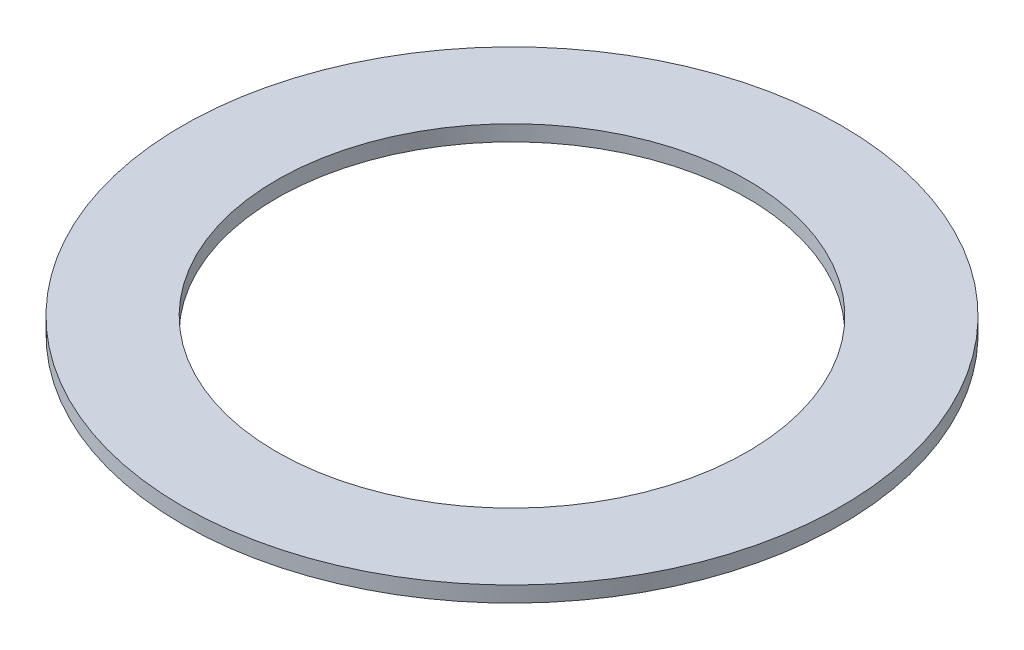
from build123d import *

# Parameters (mm, degrees)
SKETCH1_R           = 10.5
SKETCH1_R_2         = 7.5
BOSS_EXTRUDE1_DEPTH = 0.5


with BuildPart() as part:
    # Sketch1 → Boss-Extrude1 (new body)
    with BuildSketch(Plane(origin=(0, 0, 0), x_dir=(1, 0, 0), z_dir=(0, 1, 0))):
        with Locations(Location((0, 0, 0), (0, 0, 270))):
            Circle(SKETCH1_R)
        with Locations(Location((0, 0, 0), (0, 0, 270))):
            Circle(SKETCH1_R_2, mode=Mode.SUBTRACT)
    extrude(amount=BOSS_EXTRUDE1_DEPTH)


solid = part.part
